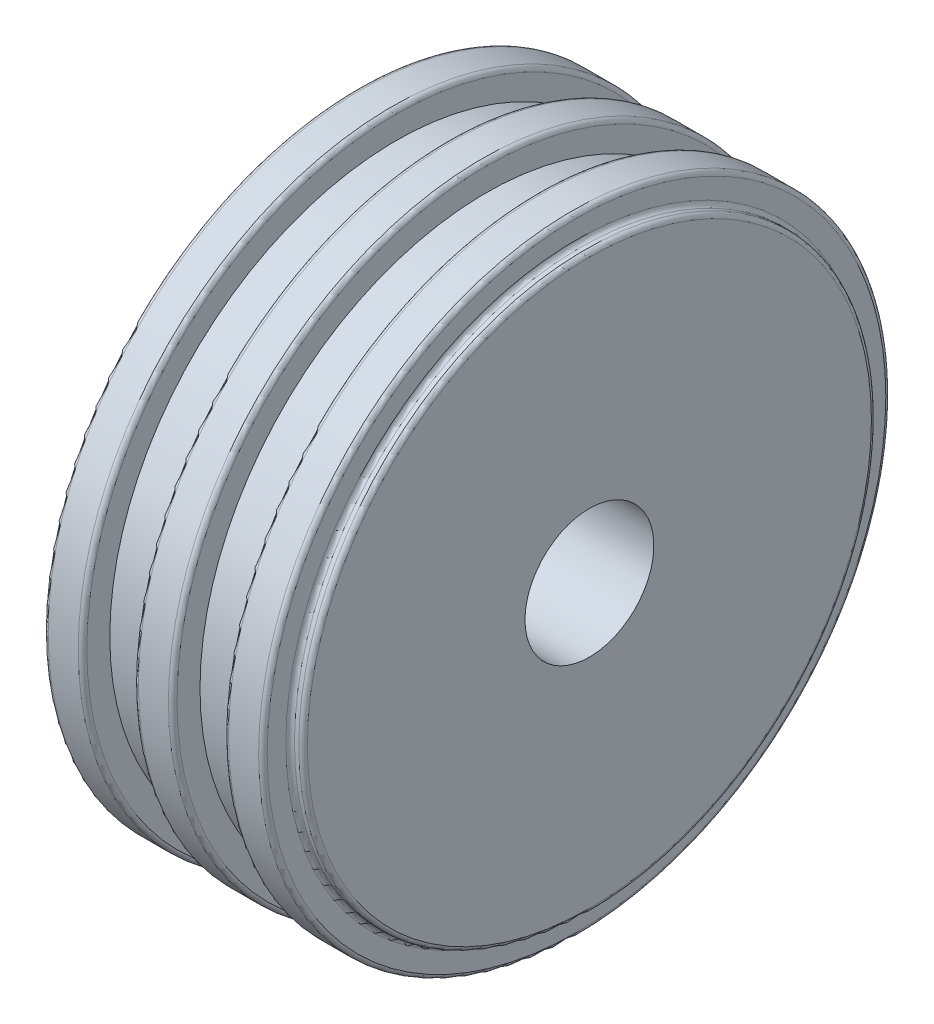
from build123d import *

# Parameters (mm, degrees)
FILLET1_R = 1


with BuildPart() as part:
    # Sketch1 → Revolve1 (revolve)
    with BuildSketch(Plane.XY, mode=Mode.PRIVATE) as revolve1_sk:
        Polygon((-3, 73.025), (-3, 66.675), (0, 66.675), (0, 15), (-57, 15), (-57, 66.675), (-54, 66.675), (-54, 73.025), (-45, 73.025), (-45, 66.675), (-33, 66.675), (-33, 73.025), (-24, 73.025), (-24, 66.675), (-12, 66.675), (-12, 73.025), align=None)
    revolve(revolve1_sk.sketch.rotate(Axis((0, 0, 0), (1, 0, 0)), 90), axis=Axis((0, 0, 0), (1, 0, 0)))

    # Fillet1
    fillet1_edges = [part.edges().sort_by_distance(p)[0] for p in [
        (-57, 0, -66.675),
        (-54, 0, -66.675),
        (-54, 0, -73.025),
        (-45, 0, -73.025),
        (-33, 0, -73.025),
        (-24, 0, -73.025),
        (-12, 0, -73.025),
        (-3, 0, -73.025),
        (-3, 0, -66.675),
        (0, 0, -66.675),
    ]]
    fillet(fillet1_edges, radius=FILLET1_R)


solid = part.part
